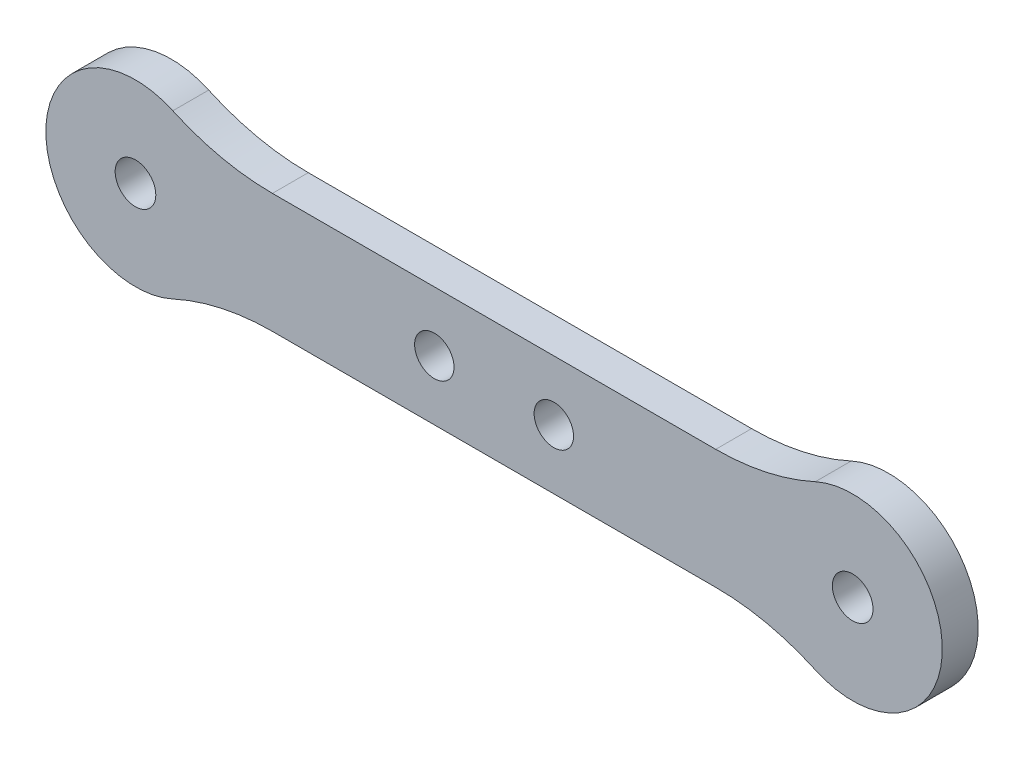
from build123d import *

# Parameters (mm, degrees)
ESBO_O1_R                = 1.7
ESBO_O1_R_2              = 1.65
RESSALTO_EXTRUS_O1_DEPTH = 3
FILETE1_R                = 20


with BuildPart() as part:
    # Esboço1 → Ressalto-extrusão1 (new body)
    with BuildSketch(Plane.XY):
        with BuildLine():
            Line((5.590169944, -5), (54.409830056, -5))
            ThreePointArc((54.409830056, -5), (67.5, 0), (54.409830056, 5))
            Line((54.409830056, 5), (5.590169944, 5))
            ThreePointArc((5.590169944, 5), (-7.5, 0), (5.590169944, -5))
        make_face()
        Circle(ESBO_O1_R, mode=Mode.SUBTRACT)
        with Locations((25, 0)):
            Circle(ESBO_O1_R_2, mode=Mode.SUBTRACT)
        with Locations((35, 0)):
            Circle(ESBO_O1_R_2, mode=Mode.SUBTRACT)
        with Locations((60, 0)):
            Circle(ESBO_O1_R, mode=Mode.SUBTRACT)
    extrude(amount=RESSALTO_EXTRUS_O1_DEPTH)

    # Filete1
    filete1_edges = [part.edges().sort_by_distance(p)[0] for p in [
        (54.409830056, -5, 1.5),
        (5.590169944, -5, 1.5),
        (5.590169944, 5, 1.5),
        (54.409830056, 5, 1.5),
    ]]
    fillet(filete1_edges, radius=FILETE1_R)


solid = part.part
